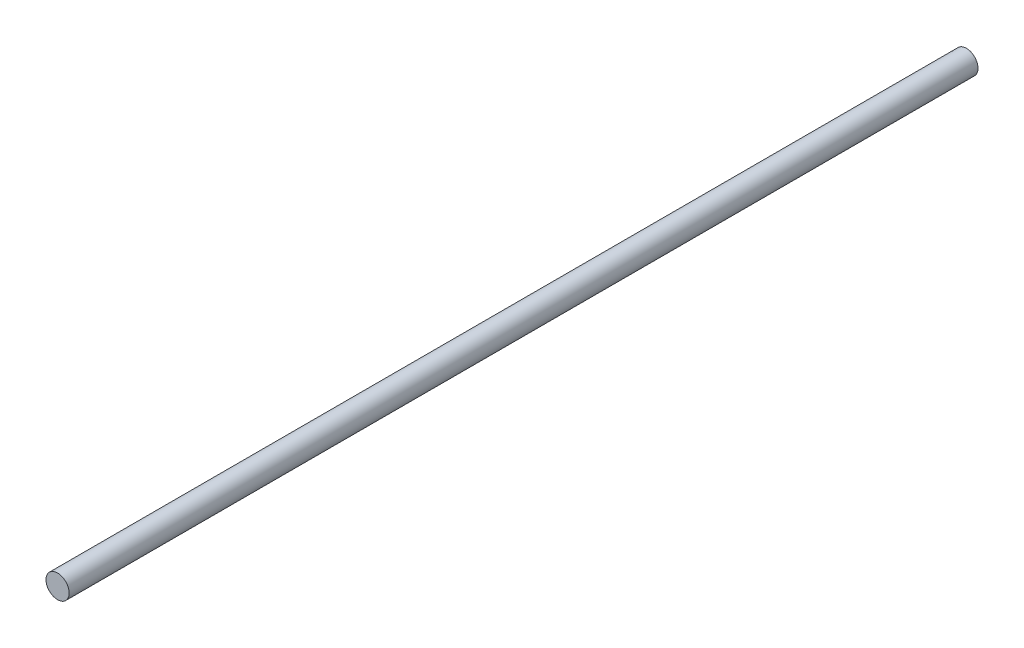
from build123d import *

# Parameters (mm, degrees)
SKETCH1_R           = 2.5
BOSS_EXTRUDE1_DEPTH = 98


with BuildPart() as part:
    # Sketch1 → Boss-Extrude1 (new, symmetric)
    with BuildSketch(Plane.XY):
        Circle(SKETCH1_R)
    extrude(amount=BOSS_EXTRUDE1_DEPTH, both=True)


solid = part.part
